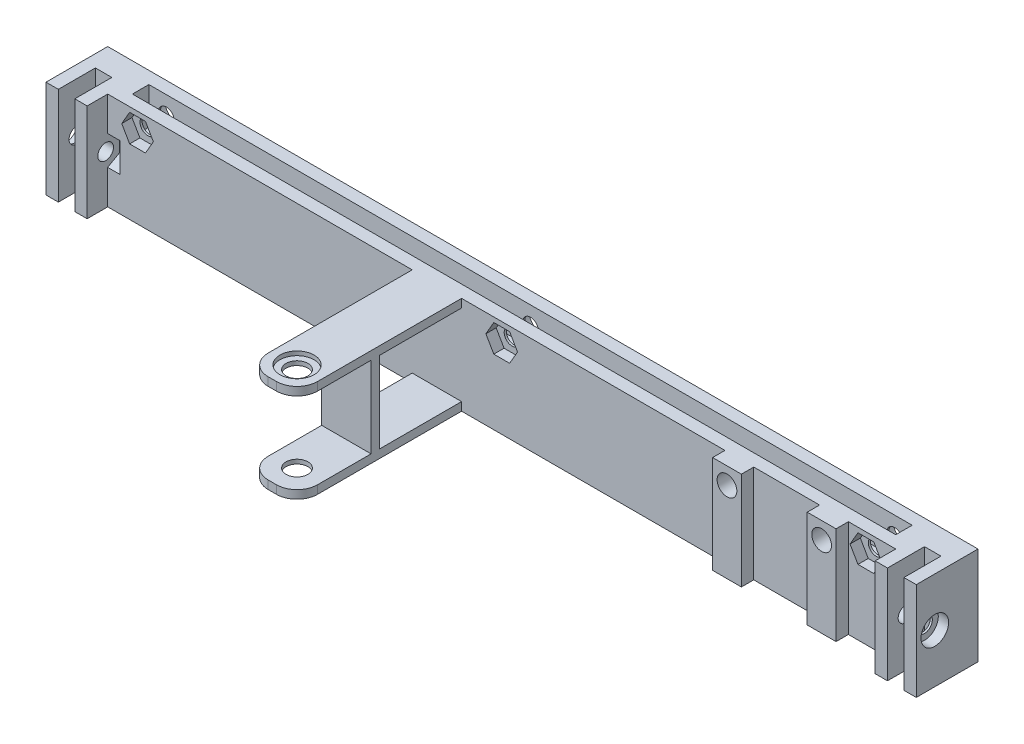
from build123d import *

# Parameters (mm, degrees)
SKETCH2_W            = 23.75
SKETCH2_H            = 12
BOSS_EXTRUDE1_DEPTH  = 10
SKETCH3_W            = 12
SKETCH3_H            = 2.025
BOSS_EXTRUDE2_DEPTH  = 40
FILLET1_R            = 5
FILLET1_OF_MIRROR1_R = 5
SKETCH5_R            = 2.65
CUT_EXTRUDE1_DEPTH   = 57.639760769
SKETCH6_R            = 4.15
CUT_EXTRUDE2_DEPTH   = 1
SKETCH7_W            = 84
SKETCH7_H            = 23.75
SKETCH7_W_2          = 115.5
BOSS_EXTRUDE3_DEPTH  = 10
SKETCH8_W            = 10
SKETCH8_H            = 23.75
BOSS_EXTRUDE4_DEPTH  = 5
BOSS_EXTRUDE7_REACH  = 130.079
SKETCH18_W           = 12
SKETCH18_H           = 2
SKETCH11_W           = 185.5
SKETCH11_H           = 4
CUT_EXTRUDE3_DEPTH   = 9
SKETCH12_R           = 1.9
CUT_EXTRUDE4_DEPTH   = 155.807138078
SKETCH15_R           = 3.35
CUT_EXTRUDE5_DEPTH   = 2.5
SKETCH16_R           = 1.9
CUT_EXTRUDE6_DEPTH   = 2.5
LPATTERN1_COUNT      = 3
LPATTERN1_PITCH      = 88.5
SKETCH14_W           = 7
SKETCH14_H           = 23.75
BOSS_EXTRUDE6_DEPTH  = 3
CUT_EXTRUDE7_REACH   = 130.079
SKETCH21_W           = 4
SKETCH21_H           = 9
LPATTERN2_COUNT      = 2
LPATTERN2_PITCH      = 201.5
SKETCH22_R           = 2.4
CUT_EXTRUDE8_DEPTH   = 3.8
SKETCH26_R           = 1.75
CUT_EXTRUDE12_DEPTH  = 0.6
LPATTERN3_COUNT      = 2
LPATTERN3_PITCH      = 23
SKETCH23_R           = 1.9
CUT_EXTRUDE9_DEPTH   = 10
SKETCH24_R           = 3.35
CUT_EXTRUDE10_DEPTH  = 2.5
CUT_EXTRUDE11_DEPTH  = 3


with BuildPart() as part:
    # Sketch2 → Boss-Extrude1 (new body)
    with BuildSketch(Plane(origin=(0, 0, 0), x_dir=(0, 1, 0), z_dir=(0, 0, 1))):
        with Locations((-83.125, 6)):
            Rectangle(SKETCH2_W, SKETCH2_H)
    extrude(amount=BOSS_EXTRUDE1_DEPTH)

    # Sketch3 → Boss-Extrude2 (add)
    with BuildSketch(Plane.XY.offset(10)):
        with Locations((-6, -72.2625)):
            Rectangle(SKETCH3_W, SKETCH3_H)
    boss_extrude2 = extrude(amount=BOSS_EXTRUDE2_DEPTH)

    # Fillet1
    fillet1_edges = [part.edges().sort_by_distance(p)[0] for p in [
        (0, -72.2625, 50),
        (-12, -72.2625, 50),
    ]]
    fillet(fillet1_edges, radius=FILLET1_R)

    # Mirror1: Boss-Extrude2 across plane
    add(boss_extrude2.mirror(Plane.ZX.offset(-83.125)))

    # Fillet1 of Mirror1
    fillet1_of_mirror1_edges = [part.edges().sort_by_distance(p)[0] for p in [
        (0, -93.9875, 50),
        (-12, -93.9875, 50),
    ]]
    fillet(fillet1_of_mirror1_edges, radius=FILLET1_OF_MIRROR1_R)

    # Sketch5 → Cut-Extrude1 (cut, through all)
    with BuildSketch(Plane.XZ.offset(95)):
        with Locations((-6, 44)):
            Circle(SKETCH5_R)
    extrude(amount=-CUT_EXTRUDE1_DEPTH, mode=Mode.SUBTRACT)

    # Sketch6 → Cut-Extrude2 (cut)
    with BuildSketch(Plane.XZ.offset(95)):
        with Locations((-6, 44)):
            Circle(SKETCH6_R)
    cut_extrude2 = extrude(amount=-CUT_EXTRUDE2_DEPTH, mode=Mode.SUBTRACT)

    # Mirror2: Cut-Extrude2 across plane
    add(cut_extrude2.mirror(Plane.ZX.offset(-83.125)), mode=Mode.SUBTRACT)

    # Sketch7 → Boss-Extrude3 (add)
    with BuildSketch(Plane(origin=(0, 0, 0), x_dir=(1, 0, 0), z_dir=(0, 0, -1))):
        with Locations((-54, 83.125)):
            Rectangle(SKETCH7_W, SKETCH7_H)
        with Locations((57.75, 83.125)):
            Rectangle(SKETCH7_W_2, SKETCH7_H)
    extrude(amount=-BOSS_EXTRUDE3_DEPTH)

    # Sketch8 → Boss-Extrude4 (add)
    with BuildSketch(Plane.XY.offset(10)):
        with Locations((110.5, -83.125)):
            Rectangle(SKETCH8_W, SKETCH8_H)
        with Locations((-91, -83.125)):
            Rectangle(SKETCH8_W, SKETCH8_H)
    extrude(amount=BOSS_EXTRUDE4_DEPTH)

    # Sketch18 → Boss-Extrude7 (add, up to next)
    with BuildSketch(Plane(origin=(0, -71.25, 0), x_dir=(-1, 0, 0), z_dir=(0, 1, 0)), mode=Mode.PRIVATE) as boss_extrude7_sk1:
        with Locations((6, 31)):
            Rectangle(SKETCH18_W, SKETCH18_H)
    boss_extrude7_tool1 = extrude(boss_extrude7_sk1.sketch, amount=-BOSS_EXTRUDE7_REACH, mode=Mode.PRIVATE) - part.part
    add(boss_extrude7_tool1.solids().sort_by_distance((-6, -71.25, 31))[0])

    # Sketch11 → Cut-Extrude3 (cut)
    with BuildSketch(Plane(origin=(0, -71.25, 0), x_dir=(-1, 0, 0), z_dir=(0, 1, 0))):
        with Locations((-9.75, 5)):
            Rectangle(SKETCH11_W, SKETCH11_H)
    cut_extrude3 = extrude(amount=-CUT_EXTRUDE3_DEPTH, mode=Mode.SUBTRACT)

    # Mirror3: Cut-Extrude3 across plane
    add(cut_extrude3.mirror(Plane.ZX.offset(-83.125)), mode=Mode.SUBTRACT)

    # Sketch12 → Cut-Extrude4 (cut, symmetric)
    with BuildSketch(Plane.XY.offset(10)):
        with Locations((-78.75, -75.75)):
            Circle(SKETCH12_R)
    cut_extrude4 = extrude(amount=CUT_EXTRUDE4_DEPTH, both=True, mode=Mode.SUBTRACT)

    # Sketch15 → Cut-Extrude5 (cut)
    with BuildSketch(Plane.XY):
        with Locations((-78.75, -75.75)):
            Circle(SKETCH15_R)
    cut_extrude5 = extrude(amount=CUT_EXTRUDE5_DEPTH, mode=Mode.SUBTRACT)

    # Sketch16 → Cut-Extrude6 (cut)
    with BuildSketch(Plane.XY.offset(10)):
        Polygon((-80.673205081, -72.418911087), (-82.596410162, -75.75), (-80.673205081, -79.081088913), (-76.826794919, -79.081088913), (-74.903589838, -75.75), (-76.826794919, -72.418911087), align=None)
        with Locations((-78.75, -75.75)):
            Circle(SKETCH16_R, mode=Mode.SUBTRACT)
    cut_extrude6 = extrude(amount=-CUT_EXTRUDE6_DEPTH, mode=Mode.SUBTRACT)

    # LPattern1: Cut-Extrude4, Cut-Extrude5, Cut-Extrude6 ×3
    with Locations(*[(i * LPATTERN1_PITCH, 0, 0) for i in range(1, LPATTERN1_COUNT)]):
        add(cut_extrude4, mode=Mode.SUBTRACT)
        add(cut_extrude5, mode=Mode.SUBTRACT)
        add(cut_extrude6, mode=Mode.SUBTRACT)

    # Sketch14 → Boss-Extrude6 (add)
    with BuildSketch(Plane.XY.offset(10)):
        with Locations((90.5, -83.125)):
            Rectangle(SKETCH14_W, SKETCH14_H)
        with Locations((67.5, -83.125)):
            Rectangle(SKETCH14_W, SKETCH14_H)
    extrude(amount=BOSS_EXTRUDE6_DEPTH)

    # Sketch21 → Cut-Extrude7 (cut, up to next)
    with BuildSketch(Plane(origin=(0, -71.25, 0), x_dir=(-1, 0, 0), z_dir=(0, 1, 0)), mode=Mode.PRIVATE) as cut_extrude7_sk1:
        with Locations((-110.5, 10.5)):
            Rectangle(SKETCH21_W, SKETCH21_H)
    cut_extrude7_tool1 = extrude(cut_extrude7_sk1.sketch, amount=-CUT_EXTRUDE7_REACH, mode=Mode.PRIVATE) & part.part
    cut_extrude7 = cut_extrude7_tool1.solids().sort_by_distance((110.5, -71.25, 10.5))[0]
    add(cut_extrude7, mode=Mode.SUBTRACT)

    # LPattern2: Cut-Extrude7 ×2
    with Locations(*[(-i * LPATTERN2_PITCH, 0, 0) for i in range(1, LPATTERN2_COUNT)]):
        add(cut_extrude7, mode=Mode.SUBTRACT)

    # Sketch22 → Cut-Extrude8 (cut)
    with BuildSketch(Plane.XY.offset(13)):
        with Locations((90.5, -75.37)):
            Circle(SKETCH22_R)
    cut_extrude8 = extrude(amount=-CUT_EXTRUDE8_DEPTH, mode=Mode.SUBTRACT)

    # Sketch26 → Cut-Extrude12 (cut)
    with BuildSketch(Plane.XY.offset(9.2)):
        with Locations((90.5, -75.37)):
            Circle(SKETCH26_R)
    cut_extrude12 = extrude(amount=-CUT_EXTRUDE12_DEPTH, mode=Mode.SUBTRACT)

    # LPattern3: Cut-Extrude8, Cut-Extrude12 ×2
    with Locations(*[(-i * LPATTERN3_PITCH, 0, 0) for i in range(1, LPATTERN3_COUNT)]):
        add(cut_extrude8, mode=Mode.SUBTRACT)
        add(cut_extrude12, mode=Mode.SUBTRACT)

    # Sketch23 → Cut-Extrude9 (cut)
    with BuildSketch(Plane.YZ.offset(115.5)):
        with Locations((-83.125, 10.5)):
            Circle(SKETCH23_R)
    cut_extrude9 = extrude(amount=-CUT_EXTRUDE9_DEPTH, mode=Mode.SUBTRACT)

    # Sketch24 → Cut-Extrude10 (cut)
    with BuildSketch(Plane.YZ.offset(115.5)):
        with Locations((-83.125, 10.5)):
            Circle(SKETCH24_R)
    cut_extrude10 = extrude(amount=-CUT_EXTRUDE10_DEPTH, mode=Mode.SUBTRACT)

    # Sketch25 → Cut-Extrude11 (cut)
    with BuildSketch(Plane(origin=(105.5, 0, 0), x_dir=(0, -1, 0), z_dir=(-1, 0, 0))):
        Polygon((81.201794919, 13.831088913), (79.278589838, 10.5), (81.201794919, 7.168911087), (85.048205081, 7.168911087), (86.971410162, 10.5), (85.048205081, 13.831088913), align=None)
    cut_extrude11 = extrude(amount=CUT_EXTRUDE11_DEPTH, mode=Mode.SUBTRACT)

    # Mirror4: Cut-Extrude9, Cut-Extrude10, Cut-Extrude11 across plane
    add(cut_extrude9.mirror(Plane(origin=(9.75, 0, 0), x_dir=(0, 0, 1), z_dir=(1, 0, 0))), mode=Mode.SUBTRACT)
    add(cut_extrude10.mirror(Plane(origin=(9.75, 0, 0), x_dir=(0, 0, 1), z_dir=(1, 0, 0))), mode=Mode.SUBTRACT)
    add(cut_extrude11.mirror(Plane(origin=(9.75, 0, 0), x_dir=(0, 0, 1), z_dir=(1, 0, 0))), mode=Mode.SUBTRACT)


solid = part.part
